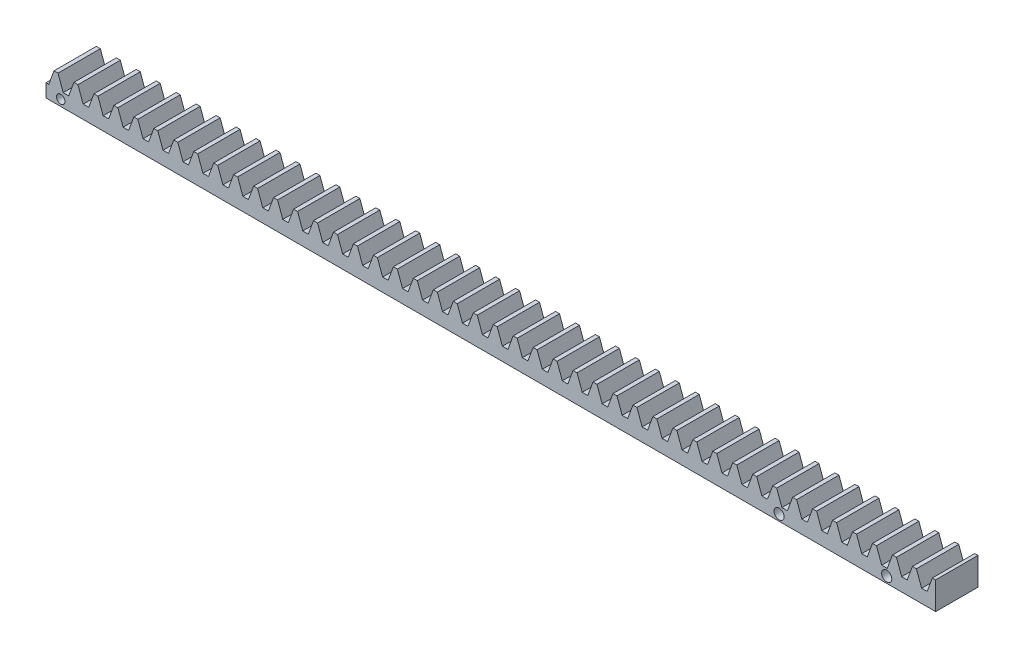
from build123d import *

# Parameters (mm, degrees)
BLANKSKE_W         = 210
BLANKSKE_H         = 6.5
BLANK_DEPTH        = 10
TOOTHCUTSIM_DEPTH  = 211.338417794
TEETHCUTS_COUNT    = 45
TEETHCUTS_PITCH    = 4.712388975
SKETCH1_R          = 1
SKETCH1_R_2        = 1.2
CUT_EXTRUDE1_DEPTH = 10


with BuildPart() as part:
    # BlankSke → Blank (new body)
    with BuildSketch(Plane.XY):
        with Locations((105, 3.25)):
            Rectangle(BLANKSKE_W, BLANKSKE_H)
    extrude(amount=-BLANK_DEPTH)

    # TooCutSkeSim → ToothCutSim (cut, through all)
    with BuildSketch(Plane.XY):
        Polygon((0.654653055, 3.125), (-0.654653055, 3.125), (-1.892297439, 6.5254), (1.892297439, 6.5254), align=None)
    toothcutsim = extrude(amount=-TOOTHCUTSIM_DEPTH, mode=Mode.SUBTRACT)

    # TeethCuts: ToothCutSim ×45
    with Locations(*[(i * TEETHCUTS_PITCH, 0, 0) for i in range(1, TEETHCUTS_COUNT)]):
        add(toothcutsim, mode=Mode.SUBTRACT)

    # Sketch1 → Cut-Extrude1 (cut)
    with BuildSketch(Plane(origin=(0, 0, -10), x_dir=(-1, 0, 0), z_dir=(0, 0, -1))):
        with Locations((-3.466384229, 1.5)):
            Circle(SKETCH1_R)
        with Locations((-198.448420537, 1.5)):
            Circle(SKETCH1_R_2)
        with Locations((-173.048420537, 1.5)):
            Circle(SKETCH1_R_2)
    extrude(amount=-CUT_EXTRUDE1_DEPTH, mode=Mode.SUBTRACT)


solid = part.part
